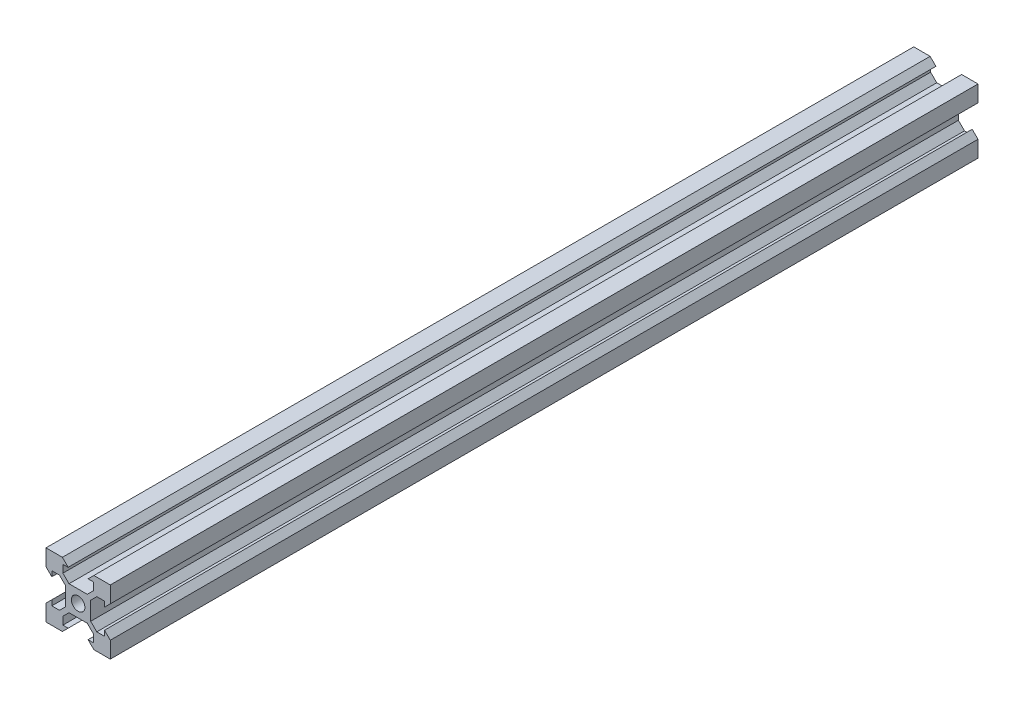
from build123d import *

# Parameters (mm, degrees)
SKETCH1_R           = 2.1
BOSS_EXTRUDE1_DEPTH = 135


with BuildPart() as part:
    # Sketch1 → Boss-Extrude1 (new, symmetric)
    with BuildSketch(Plane.XY):
        Polygon((-3.900660172, -2.84), (-3.900660172, 2.84), (-5.800660172, 4.74), (-8.2, 4.74), (-8.2, 3.1), (-10, 4.9), (-10, 10), (-4.9, 10), (-3.1, 8.2), (-4.74, 8.2), (-4.74, 5.800660172), (-2.84, 3.900660172), (0, 3.900660172), (2.84, 3.900660172), (4.74, 5.800660172), (4.74, 8.2), (3.1, 8.2), (4.9, 10), (10, 10), (10, 4.9), (8.2, 3.1), (8.2, 4.74), (5.800660172, 4.74), (3.900660172, 2.84), (3.900660172, -2.84), (5.800660172, -4.74), (8.2, -4.74), (8.2, -3.1), (10, -4.9), (10, -10), (4.9, -10), (3.1, -8.2), (4.74, -8.2), (4.74, -5.800660172), (2.84, -3.900660172), (0, -3.900660172), (-2.84, -3.900660172), (-4.74, -5.800660172), (-4.74, -8.2), (-3.1, -8.2), (-4.9, -10), (-10, -10), (-10, -4.9), (-8.2, -3.1), (-8.2, -4.74), (-5.800660172, -4.74), align=None)
        Circle(SKETCH1_R, mode=Mode.SUBTRACT)
    extrude(amount=BOSS_EXTRUDE1_DEPTH, both=True)


solid = part.part
